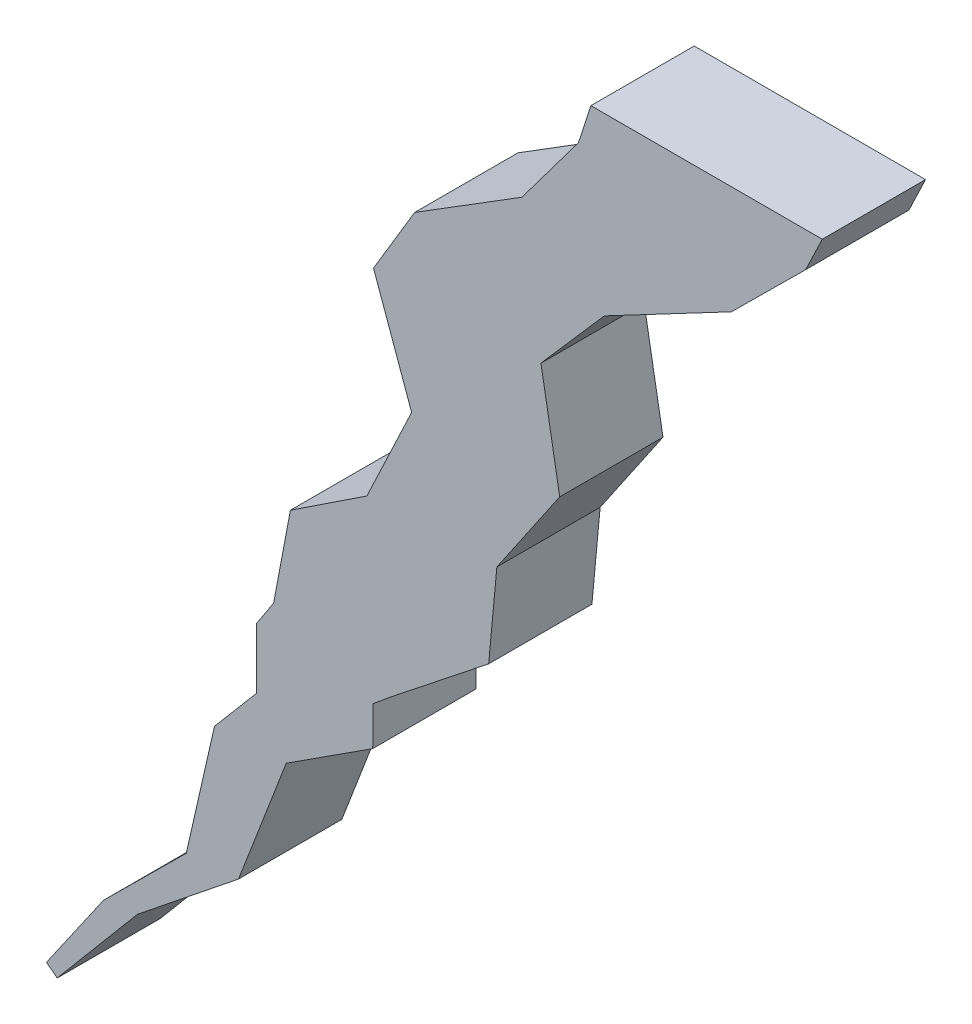
from build123d import *

# Parameters (mm, degrees)
AUFSATZ_LINEAR_AUSTRAGEN1_DEPTH = 3


with BuildPart() as part:
    # Model → Aufsatz-Linear austragen1 (new body)
    with BuildSketch(Plane.XY):
        Polygon((22.669608187, 29.831204), (22.188254495, 28.823301164), (20.029005709, 26.684117371), (16.339265868, 24.737217786), (14.498965151, 22.62858081), (15.044379603, 19.537403462), (13.218316497, 16.861158349), (12.980303819, 14.304274033), (10.129069723, 12.044518615), (9.626848101, 11.62740905), (9.612828785, 10.488501279), (7.100635351, 8.864665792), (5.715215665, 5.258790161), (2.775458884, 2.901079345), (0.449752745, 0.137265819), (0.136683146, 0.375705994), (1.793710632, 2.76465522), (4.196594718, 5.14715647), (5.0166029, 8.752360921), (6.241488931, 10.197342725), (6.233272131, 11.941748071), (6.734705117, 12.710559101), (7.221408343, 15.289524307), (9.442939213, 16.758152538), (10.742599947, 19.509470864), (9.635959583, 22.588127854), (10.831412224, 24.585358485), (13.948835588, 26.527667637), (15.587725571, 28.717843712), (15.949772024, 29.831204), align=None)
    extrude(amount=AUFSATZ_LINEAR_AUSTRAGEN1_DEPTH)


solid = part.part
